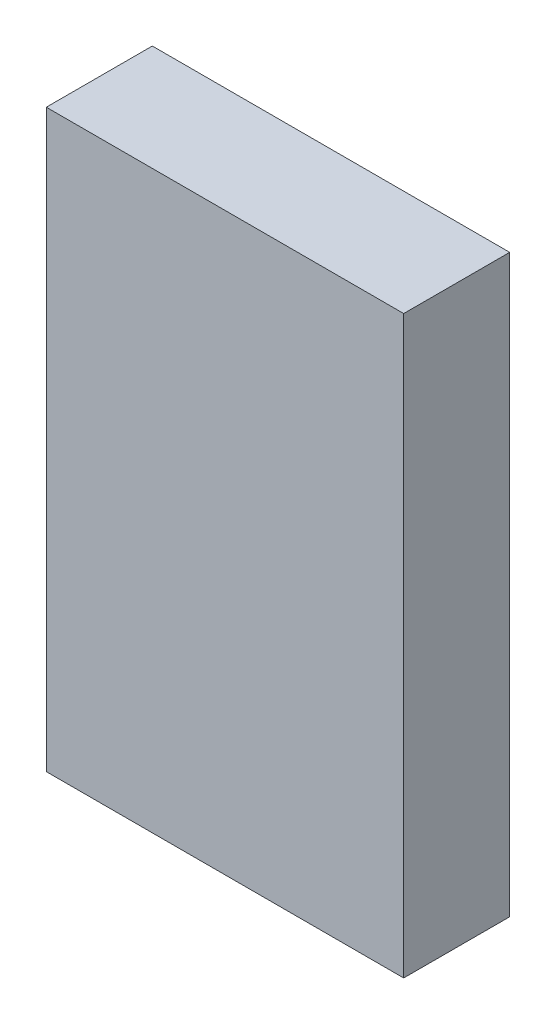
from build123d import *

# Parameters (mm, degrees)
SKETCH1_W           = 11.8
SKETCH1_H           = 19
BOSS_EXTRUDE1_DEPTH = 1.75


with BuildPart() as part:
    # Sketch1 → Boss-Extrude1 (new, symmetric)
    with BuildSketch(Plane.XY):
        Rectangle(SKETCH1_W, SKETCH1_H)
    extrude(amount=BOSS_EXTRUDE1_DEPTH, both=True)


solid = part.part
